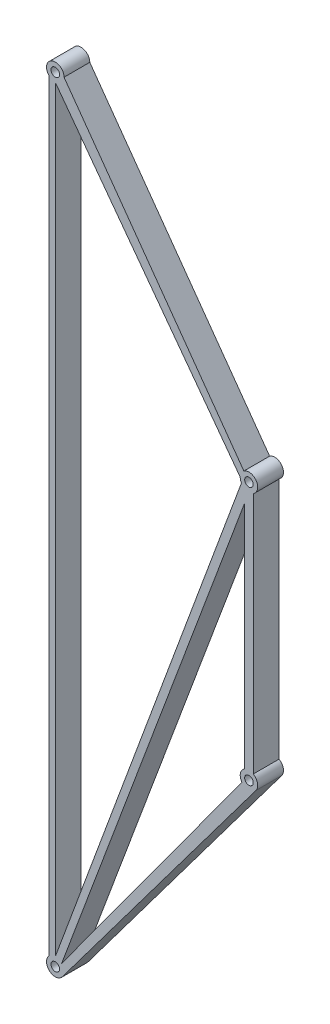
from build123d import *

# Parameters (mm, degrees)
SKETCH9_R           = 6.65
BOSS_EXTRUDE1_DEPTH = 39.9


with BuildPart() as part:
    # Sketch9 → Boss-Extrude1 (new body)
    with BuildSketch(Plane(origin=(0, 0, 0), x_dir=(0, 1, 0), z_dir=(0, 0, 1))):
        with BuildLine():
            Line((800, 286.45), (411.016496764, 7.889188745))
            ThreePointArc((411.016496764, 7.889188745), (407.294864157, -11.41873272), (388.21106152, -6.680077058))
            Line((388.21106152, -6.680077058), (11.78893848, -6.680077058))
            ThreePointArc((11.78893848, -6.680077058), (2.770053686, -13.263834384), (-8.13, -10.84))
            Line((-8.13, -10.84), (-408.13, 289.16))
            ThreePointArc((-408.13, 289.16), (-410.355747525, 308.738477739), (-390.681827116, 309.837385532))
            Line((-390.681827116, 309.837385532), (790.681827116, 309.837385532))
            ThreePointArc((790.681827116, 309.837385532), (812.58767401, 305.015272976), (800, 286.45))
        make_face()
        with Locations(Location((-400, 300, 0), (0, 0, 270))):
            Circle(SKETCH9_R, mode=Mode.SUBTRACT)
        with Locations(Location((0, 0, 0), (0, 0, 270))):
            Circle(SKETCH9_R, mode=Mode.SUBTRACT)
        with Locations(Location((400, 0, 0), (0, 0, 270))):
            Circle(SKETCH9_R, mode=Mode.SUBTRACT)
        with Locations(Location((800, 300, 0), (0, 0, 270))):
            Circle(SKETCH9_R, mode=Mode.SUBTRACT)
        with BuildLine():
            Line((-386.45, 300), (393.040410471, 11.626117735))
            ThreePointArc((393.040410471, 11.626117735), (396.389694979, 13.060176019), (400, 13.55))
            Line((400, 13.55), (786.45, 300))
            Line((786.45, 300), (-386.45, 300))
        make_face(mode=Mode.SUBTRACT)
        with BuildLine():
            Line((-390.681827116, 290.162614468), (368.558996023, 6.680077058))
            Line((368.558996023, 6.680077058), (11.78893848, 6.680077058))
            ThreePointArc((11.78893848, 6.680077058), (2.770053686, 13.263834384), (-8.13, 10.84))
            Line((-8.13, 10.84), (-390.681827116, 290.162614468))
        make_face(mode=Mode.SUBTRACT)
    extrude(amount=BOSS_EXTRUDE1_DEPTH)


solid = part.part
